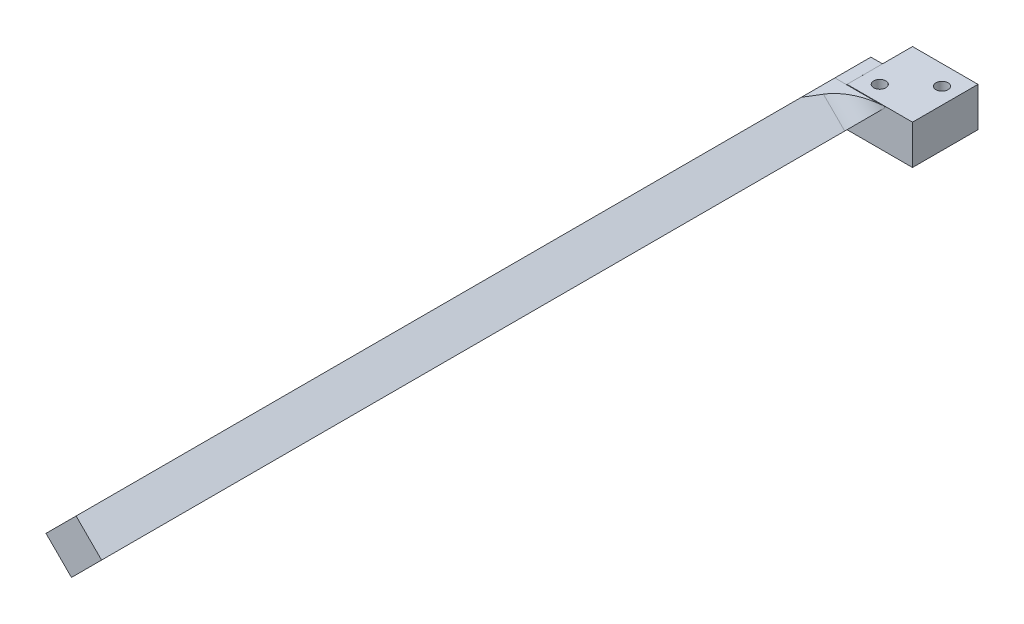
from build123d import *

# Parameters (mm, degrees)
CROQUIS1_W               = 20
CROQUIS1_H               = 12
SALIENTE_EXTRUIR1_DEPTH  = 20
CROQUIS2_R               = 1.85
CORTAR_EXTRUIR1_DEPTH    = 20
CROQUIS4_R               = 1.388846163
CORTAR_EXTRUIR2_DEPTH    = 1
SALIENTE_EXTRUIR11_DEPTH = 11
SALIENTE_EXTRUIR13_DEPTH = 11
CORTAR_EXTRUIR3_DEPTH    = 11


with BuildPart() as part:
    # Croquis1 → Saliente-Extruir1 (new body)
    with BuildSketch(Plane.XY):
        with Locations((-37.08078701, -216.519902539)):
            Rectangle(CROQUIS1_W, CROQUIS1_H)
    extrude(amount=SALIENTE_EXTRUIR1_DEPTH)

    # Croquis2 → Cortar-Extruir1 (cut)
    with BuildSketch(Plane.XZ.offset(222.519902539)):
        with Locations(Location((-42.08078701, 15, 0), (0, 0, 270))):
            Circle(CROQUIS2_R)
        with Locations(Location((-32.08078701, 6, 0), (0, 0, 270))):
            Circle(CROQUIS2_R)
    extrude(amount=-CORTAR_EXTRUIR1_DEPTH, mode=Mode.SUBTRACT)

    # Croquis4 → Cortar-Extruir2 (cut)
    with BuildSketch(Plane.ZY.offset(47.08078701)):
        with Locations((3.718956932, -216.708306212)):
            Circle(CROQUIS4_R)
    extrude(amount=-CORTAR_EXTRUIR2_DEPTH, mode=Mode.SUBTRACT)


with BuildPart() as body_2:
    # Croquis5 → Saliente-Extruir11 (new body)
    with BuildSketch(Plane(origin=(87.719557765, -87.719557765, -86.975665722), x_dir=(0, 0, -1), z_dir=(-0.7071067811865438, 0.7071067811865512, 0))):
        with BuildLine():
            Line((-286.975665722, 258.009058794), (-286.975665722, 271.009058794))
            Line((-286.975665722, 271.009058794), (-101.130322174, 190.637475792))
            Line((-101.130322174, 190.637475792), (-107.130322174, 190.637475792))
            Line((-107.130322174, 190.637475792), (-107.130322174, 173.637475792))
            ThreePointArc((-107.130322174, 173.637475792), (-108.778973076, 179.149031664), (-113.18332434, 182.84997585))
            Line((-113.18332434, 182.84997585), (-286.975665722, 258.009058794))
        make_face()
    extrude(amount=SALIENTE_EXTRUIR11_DEPTH)

    # Croquis6 → Saliente-Extruir13 (add)
    with BuildSketch(Plane(origin=(0, 0, 20.154656453), x_dir=(-1, 0, 0), z_dir=(0, 0, -1))):
        Polygon((47.08178701, -222.520316752), (54.859668709, -214.742435052), (50.637136196, -210.519902539), (47.08178701, -210.519902539), align=None)
    extrude(amount=SALIENTE_EXTRUIR13_DEPTH)

    # Croquis7 → Cortar-Extruir3 (cut)
    with BuildSketch(Plane(origin=(0, 0, 20.154656453), x_dir=(-1, 0, 0), z_dir=(0, 0, -1))):
        Polygon((47.08078701, -210.519802539), (50.637036196, -210.519802539), (42.838853429, -202.721619772), (35.060678836, -210.499794365), (35.08068701, -210.519802539), align=None)
    extrude(amount=-CORTAR_EXTRUIR3_DEPTH, mode=Mode.SUBTRACT)


solid = Compound([part.part, body_2.part])
